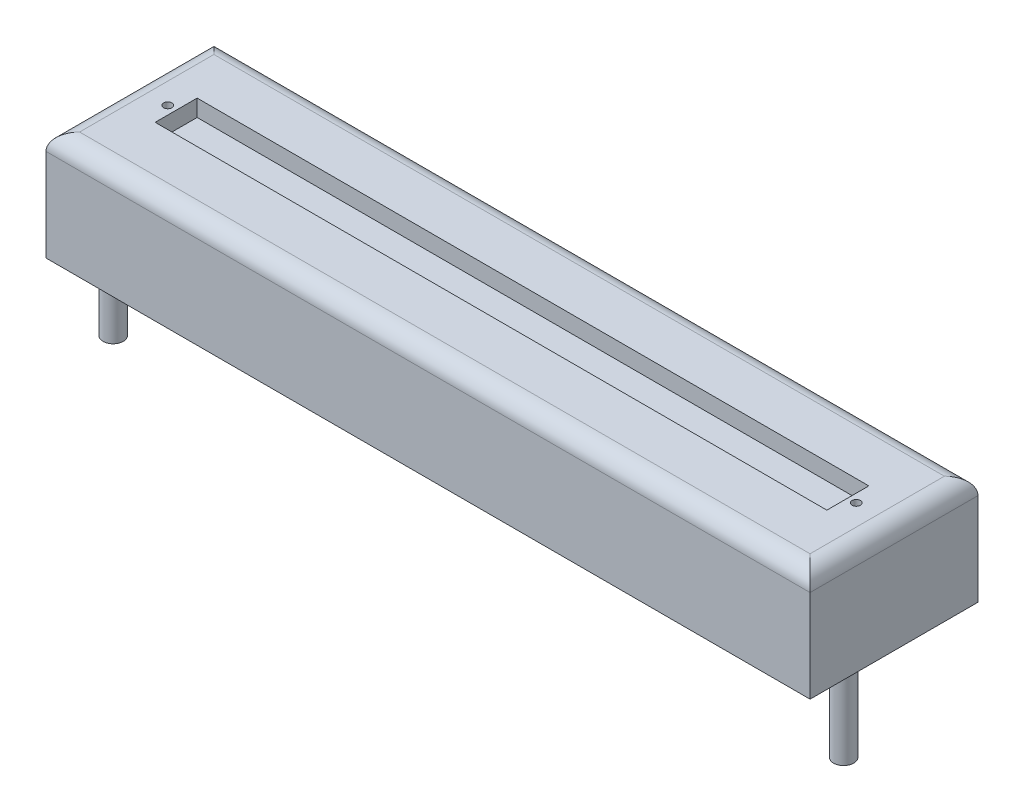
from build123d import *

# Parameters (mm, degrees)
SKETCH1_W           = 45.5
SKETCH1_H           = 10
SKETCH1_R           = 0.25
BOSS_EXTRUDE1_DEPTH = 6.5
SKETCH2_R           = 0.6
BOSS_EXTRUDE2_DEPTH = 5
SKETCH4_W           = 40
SKETCH4_H           = 2.5
CUT_EXTRUDE1_DEPTH  = 1
FILLET1_R           = 1


with BuildPart() as part:
    # Sketch1 → Boss-Extrude1 (new body)
    with BuildSketch(Plane(origin=(0, 0, 0), x_dir=(1, 0, 0), z_dir=(0, 1, 0))):
        Rectangle(SKETCH1_W, SKETCH1_H)
        with Locations(Location((-20.5, 0, 0), (0, 0, 270))):
            Circle(SKETCH1_R, mode=Mode.SUBTRACT)
        with Locations(Location((20.5, 0, 0), (0, 0, 270))):
            Circle(SKETCH1_R, mode=Mode.SUBTRACT)
    extrude(amount=BOSS_EXTRUDE1_DEPTH)

    # Sketch2 → Boss-Extrude2 (add)
    with BuildSketch(Plane.XZ):
        with Locations(Location((-21.75, 2, 0), (0, 0, 90))):
            Circle(SKETCH2_R)
        with Locations(Location((-21.75, -2, 0), (0, 0, 90))):
            Circle(SKETCH2_R)
        with Locations(Location((21.75, 2, 0), (0, 0, 90))):
            Circle(SKETCH2_R)
    extrude(amount=BOSS_EXTRUDE2_DEPTH)

    # Sketch4 → Cut-Extrude1 (cut)
    with BuildSketch(Plane(origin=(0, 6.5, 0), x_dir=(1, 0, 0), z_dir=(0, 1, 0))):
        Rectangle(SKETCH4_W, SKETCH4_H)
    extrude(amount=-CUT_EXTRUDE1_DEPTH, mode=Mode.SUBTRACT)

    # Fillet1
    fillet1_edges = [part.edges().sort_by_distance(p)[0] for p in [
        (22.75, 6.5, 0),
        (0, 6.5, -5),
        (-22.75, 6.5, 0),
        (0, 6.5, 5),
    ]]
    fillet(fillet1_edges, radius=FILLET1_R)


solid = part.part
